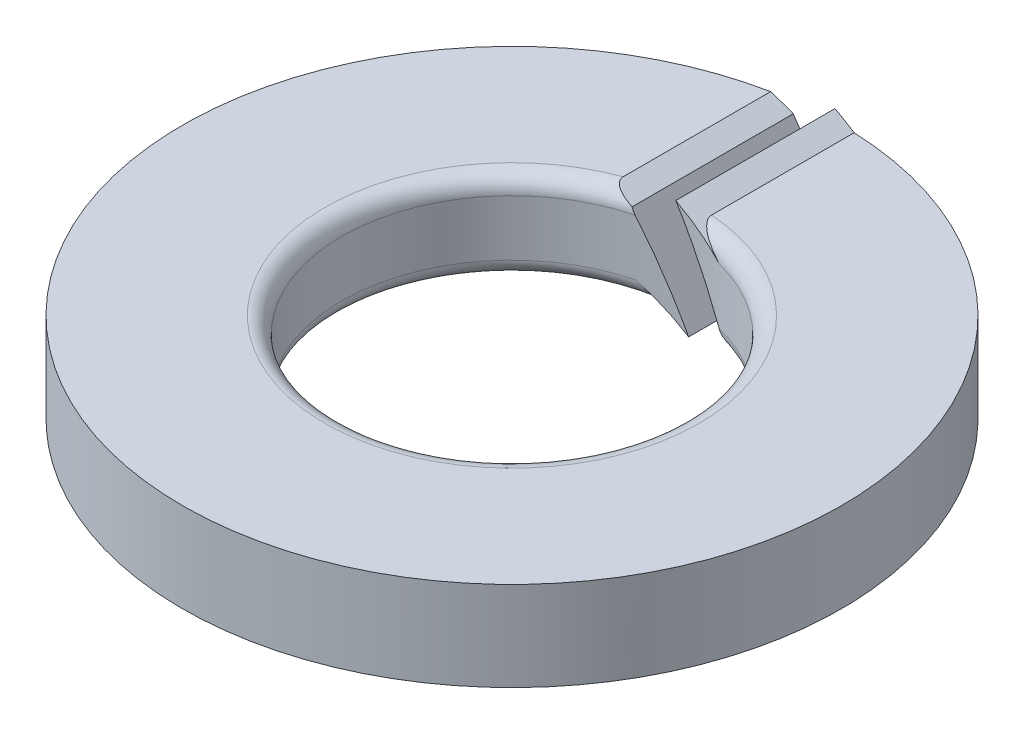
from build123d import *

# Parameters (mm, degrees)
BODYSKE_W       = 2.85
BODYSKE_H       = 20
CUT_EXTRASKE_W  = 11.8
CUT_EXTRASKE_H  = 9.2
CUT_EXTRA_DEPTH = 14.023824323
TYPE_A_DEPTH    = 14.023824323
FILLET1_R       = 0.3


with BuildPart() as part:
    # BodySke → BaseBody (revolve)
    with BuildSketch(Plane.XY, mode=Mode.PRIVATE) as basebody_sk:
        with Locations((4.475, 0)):
            Rectangle(BODYSKE_W, BODYSKE_H)
    revolve(basebody_sk.sketch.rotate(Axis((0, 0, 0), (0, 1, 0)), 90), axis=Axis((0, 0, 0), (0, 1, 0)))

    # Cut-ExtraSke → Cut-Extra (cut, through all)
    with BuildSketch(Plane.XY):
        with Locations((0, -5.4)):
            Rectangle(CUT_EXTRASKE_W, CUT_EXTRASKE_H)
        with Locations((0, 5.4)):
            Rectangle(CUT_EXTRASKE_W, CUT_EXTRASKE_H)
    extrude(amount=CUT_EXTRA_DEPTH, mode=Mode.SUBTRACT)

    # ASke → Type-A (cut, through all)
    with BuildSketch(Plane.XY):
        Polygon((0.115470054, -1), (-0.230940108, -0.8), (-5.9, -0.8), (-5.9, -10), (5.9, -10), (5.9, -0.8), (1.154700538, -0.8), (0.808290377, -0.6), (-0.115470054, 1), (0.230940108, 0.8), (5.9, 0.8), (5.9, 10), (-5.9, 10), (-5.9, 0.8), (-1.154700538, 0.8), (-0.808290377, 0.6), align=None)
    extrude(amount=-TYPE_A_DEPTH, mode=Mode.SUBTRACT)

    # Fillet1
    fillet1_edges = [part.edges().sort_by_distance(p)[0] for p in [
        (-0.474598894, -0.8, 3.012848468),
        (0.474598894, 0.8, 3.012848468),
    ]]
    fillet(fillet1_edges, radius=FILLET1_R)


solid = part.part
